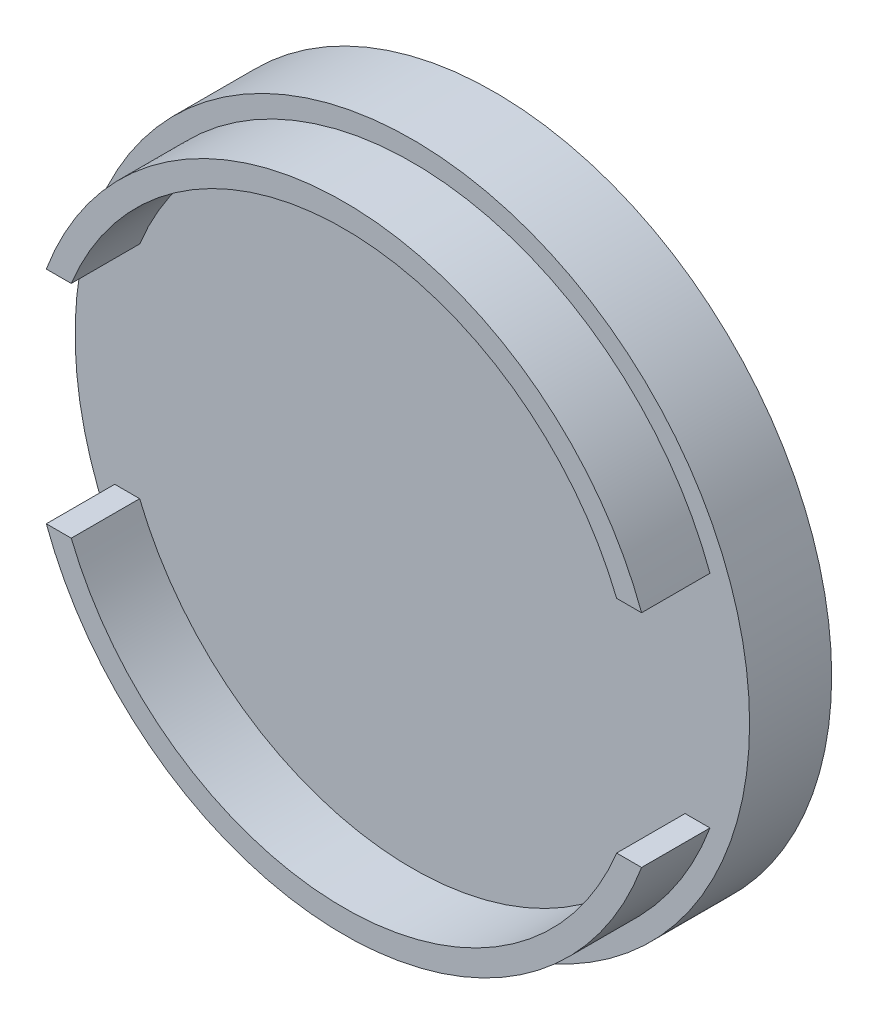
from build123d import *

# Parameters (mm, degrees)
SKETCH1_R           = 24.65
BOSS_EXTRUDE1_DEPTH = 6
SKETCH2_R           = 23.2
SKETCH2_R_2         = 21.5
BOSS_EXTRUDE2_DEPTH = 5
CUT_EXTRUDE1_START  = -5
CUT_EXTRUDE1_DEPTH  = 5


with BuildPart() as part:
    # Sketch1 → Boss-Extrude1 (new body)
    with BuildSketch(Plane.XY):
        Circle(SKETCH1_R)
    extrude(amount=BOSS_EXTRUDE1_DEPTH)

    # Sketch2 → Boss-Extrude2 (add)
    with BuildSketch(Plane.XY.offset(6)):
        Circle(SKETCH2_R)
        Circle(SKETCH2_R_2, mode=Mode.SUBTRACT)
    extrude(amount=BOSS_EXTRUDE2_DEPTH)

    # Sketch3 → Cut-Extrude1 (cut)
    with BuildSketch(Plane.XY.offset(11).offset(CUT_EXTRUDE1_START)):
        with BuildLine():
            Line((-21.754599502, 8.060856065), (-19.931698359, 8.060856065))
            ThreePointArc((-19.931698359, 8.060856065), (-21.5, 0), (-19.931698359, -8.060856065))
            Line((-19.931698359, -8.060856065), (-21.754599502, -8.060856065))
            ThreePointArc((-21.754599502, -8.060856065), (-23.2, 0), (-21.754599502, 8.060856065))
        make_face()
        with BuildLine():
            Line((21.754599502, -8.060856065), (19.931698359, -8.060856065))
            ThreePointArc((19.931698359, -8.060856065), (21.5, 0), (19.931698359, 8.060856065))
            Line((19.931698359, 8.060856065), (21.754599502, 8.060856065))
            ThreePointArc((21.754599502, 8.060856065), (23.2, 0), (21.754599502, -8.060856065))
        make_face()
    extrude(amount=CUT_EXTRUDE1_DEPTH, mode=Mode.SUBTRACT)


solid = part.part
